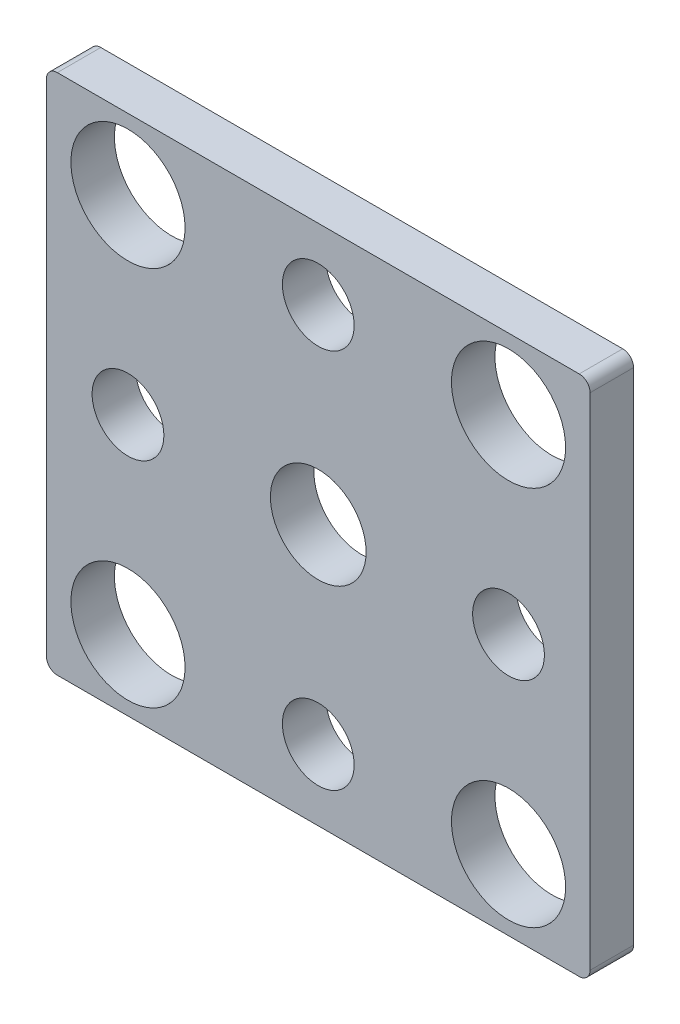
from build123d import *

# Parameters (mm, degrees)
SKETCH_1_W          = 50
SKETCH_1_H          = 48
EXTRUDE_1_DEPTH     = 4
FILLET_1_R          = 1
SKETCH_2_R          = 5.25
CUT_EXTRUDE_1_DEPTH = 70.426219831
CUT_EXTRUDE_2_DEPTH = 70.426219831


with BuildPart() as part:
    # 草图1 → 凸台-拉伸1 (new body)
    with BuildSketch(Plane.XY):
        with Locations((25, -24)):
            Rectangle(SKETCH_1_W, SKETCH_1_H)
    extrude(amount=EXTRUDE_1_DEPTH)

    # 圆角1
    fillet_1_edges = [part.edges().sort_by_distance(p)[0] for p in [
        (0, 0, 2),
        (50, 0, 2),
        (50, -48, 2),
        (0, -48, 2),
    ]]
    fillet(fillet_1_edges, radius=FILLET_1_R)

    # 草图2 → 切除-拉伸1 (cut, through all)
    with BuildSketch(Plane.XY.offset(4)):
        with Locations((7.5, -6.5)):
            Circle(SKETCH_2_R)
        with Locations((42.5, -6.5)):
            Circle(SKETCH_2_R)
        with Locations((42.5, -41.5)):
            Circle(SKETCH_2_R)
        with Locations((7.5, -41.5)):
            Circle(SKETCH_2_R)
        with BuildLine():
            Line((25, -24), (29.4, -24))
            ThreePointArc((29.4, -24), (28.111269837, -20.888730163), (25, -19.6))
            Line((25, -19.6), (25, -24))
        make_face()
        with BuildLine():
            Line((20.6, -24), (25, -24))
            Line((25, -24), (25, -19.6))
            ThreePointArc((25, -19.6), (21.888730163, -20.888730163), (20.6, -24))
        make_face()
        with BuildLine():
            ThreePointArc((25, -28.4), (28.111269837, -27.111269837), (29.4, -24))
            Line((29.4, -24), (25, -24))
            Line((25, -24), (25, -28.4))
        make_face()
        with BuildLine():
            Line((25, -28.4), (25, -24))
            Line((25, -24), (20.6, -24))
            ThreePointArc((20.6, -24), (21.888730163, -27.111269837), (25, -28.4))
        make_face()
    extrude(amount=-CUT_EXTRUDE_1_DEPTH, mode=Mode.SUBTRACT)

    # 草图9 → 切除-拉伸2 (cut, through all)
    with BuildSketch(Plane.XY.offset(4)):
        with BuildLine():
            ThreePointArc((4.2, -24), (7.5, -27.3), (10.8, -24))
            Line((10.8, -24), (4.2, -24))
        make_face()
        with BuildLine():
            Line((4.2, -24), (10.8, -24))
            ThreePointArc((10.8, -24), (7.5, -20.7), (4.2, -24))
        make_face()
        with BuildLine():
            ThreePointArc((39.2, -24), (42.5, -27.3), (45.8, -24))
            Line((45.8, -24), (39.2, -24))
        make_face()
        with BuildLine():
            Line((39.2, -24), (45.8, -24))
            ThreePointArc((45.8, -24), (42.5, -20.7), (39.2, -24))
        make_face()
        with BuildLine():
            ThreePointArc((25, -3.2), (21.7, -6.5), (25, -9.8))
            Line((25, -9.8), (25, -3.2))
        make_face()
        with BuildLine():
            Line((25, -3.2), (25, -9.8))
            ThreePointArc((25, -9.8), (27.333452378, -8.833452378), (28.3, -6.5))
            ThreePointArc((28.3, -6.5), (27.333452378, -4.166547622), (25, -3.2))
        make_face()
        with BuildLine():
            ThreePointArc((28.3, -41.5), (27.333452378, -39.166547622), (25, -38.2))
            Line((25, -38.2), (25, -44.8))
            ThreePointArc((25, -44.8), (27.333452378, -43.833452378), (28.3, -41.5))
        make_face()
        with BuildLine():
            Line((25, -44.8), (25, -38.2))
            ThreePointArc((25, -38.2), (21.7, -41.5), (25, -44.8))
        make_face()
    extrude(amount=-CUT_EXTRUDE_2_DEPTH, mode=Mode.SUBTRACT)


solid = part.part
